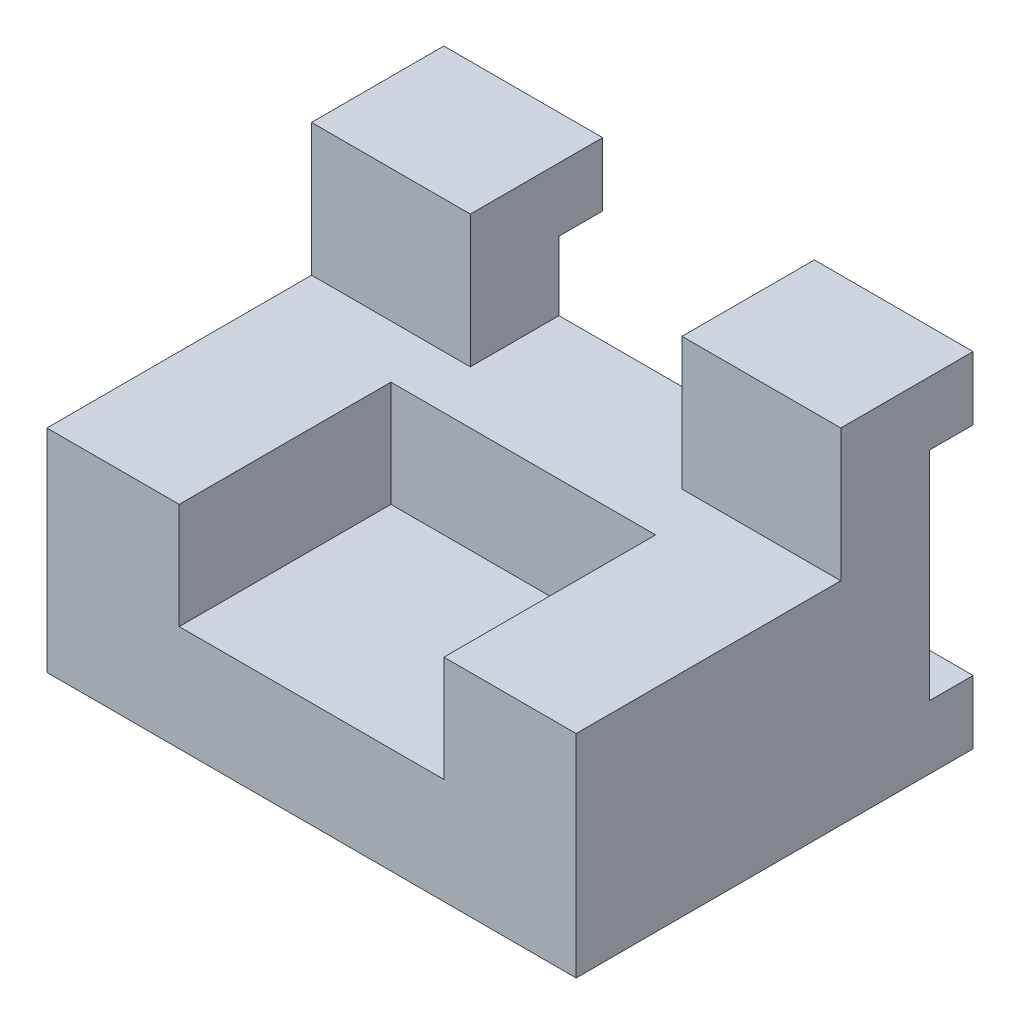
from build123d import *

# Parameters (mm, degrees)
SKETCH1_W               = 100
SKETCH1_H               = 65
BOSS_EXTRUDE1_DEPTH     = 25
CUT_EXTRUDE1_REACH      = 123.861
SKETCH2_W               = 8.232646472
SKETCH2_H               = 41
SKETCH3_W               = 40
SKETCH3_H               = 25
CUT_EXTRUDE2_DEPTH      = 25
BOSS_EXTRUDE2_DEPTH     = 50
CUT_EXTRUDE3_DEPTH      = 132.244047484
CUT_EXTRUDE3_DEPTH_BACK = 20


with BuildPart() as part:
    # Sketch1 → Boss-Extrude1 (new body)
    with BuildSketch(Plane.XY):
        with Locations((50, 32.5)):
            Rectangle(SKETCH1_W, SKETCH1_H)
    extrude(amount=BOSS_EXTRUDE1_DEPTH)

    # Sketch2 → Cut-Extrude1 (cut, up to next)
    with BuildSketch(Plane(origin=(100, 0, 0), x_dir=(0, 0, -1), z_dir=(1, 0, 0)), mode=Mode.PRIVATE) as cut_extrude1_sk1:
        with Locations((-4.116323236, 32.5)):
            Rectangle(SKETCH2_W, SKETCH2_H)
    cut_extrude1_tool1 = extrude(cut_extrude1_sk1.sketch, amount=-CUT_EXTRUDE1_REACH, mode=Mode.PRIVATE) & part.part
    add(cut_extrude1_tool1.solids().sort_by_distance((100, 32.5, 4.116323))[0], mode=Mode.SUBTRACT)

    # Sketch3 → Cut-Extrude2 (cut)
    with BuildSketch(Plane(origin=(0, 65, 0), x_dir=(1, 0, 0), z_dir=(0, 1, 0))):
        with Locations((50, -12.5)):
            Rectangle(SKETCH3_W, SKETCH3_H)
    extrude(amount=-CUT_EXTRUDE2_DEPTH, mode=Mode.SUBTRACT)

    # Sketch4 → Boss-Extrude2 (add)
    with BuildSketch(Plane.XY.offset(25)):
        Polygon((30, 40), (0, 40), (0, 0), (100, 0), (100, 40), (70, 40), align=None)
    extrude(amount=BOSS_EXTRUDE2_DEPTH)

    # Sketch6 → Cut-Extrude3 (cut, two sides: drawn at the far end of the back side and taken through both)
    with BuildSketch(Plane(origin=(0, 40, 0), x_dir=(1, 0, 0), z_dir=(0, 1, 0)).offset(-CUT_EXTRUDE3_DEPTH_BACK)):
        Polygon((75, -297.132034356), (75, -75), (75, -35), (25, -35), (25, -75), (25, -297.132034356), (25, -741.396103068), (75, -741.396103068), align=None)
    extrude(amount=CUT_EXTRUDE3_DEPTH + CUT_EXTRUDE3_DEPTH_BACK, mode=Mode.SUBTRACT)


solid = part.part
